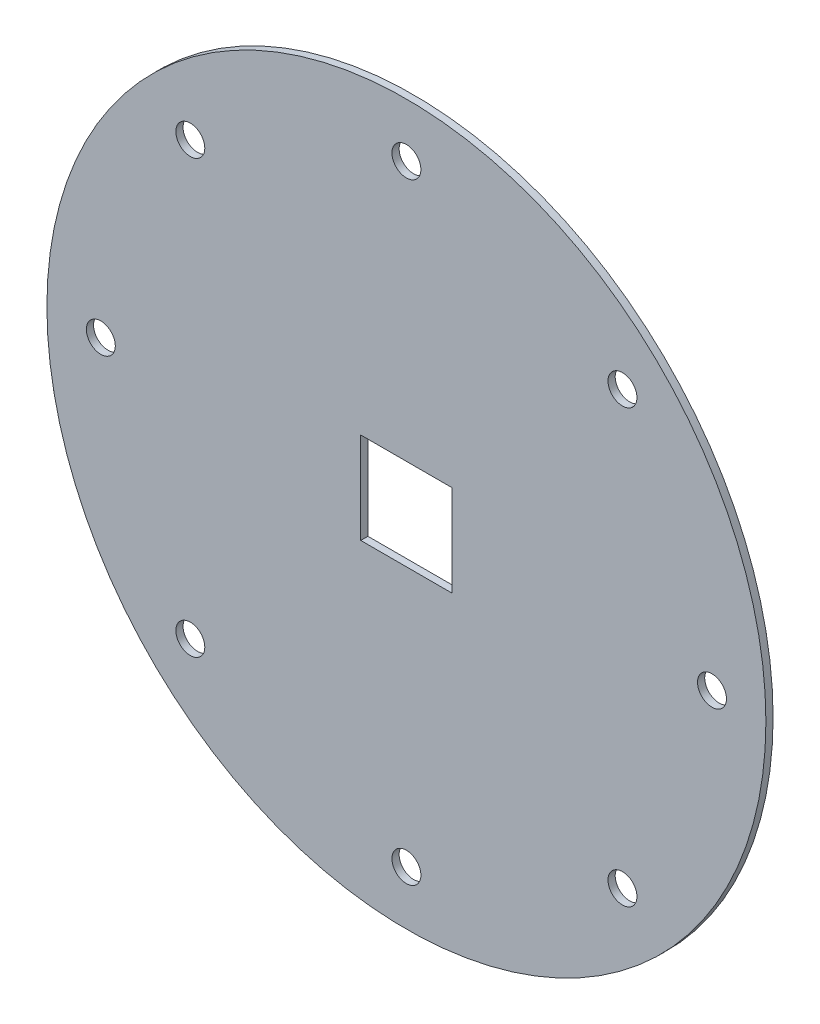
from build123d import *

# Parameters (mm, degrees)
CROQUIS1_R              = 100
CROQUIS1_R_2            = 4.025
CROQUIS1_W              = 25.4
CROQUIS1_H              = 25.4
SALIENTE_EXTRUIR1_DEPTH = 2


with BuildPart() as part:
    # Croquis1 → Saliente-Extruir1 (new body)
    with BuildSketch(Plane.XY):
        Circle(CROQUIS1_R)
        with Locations((0, 85)):
            Circle(CROQUIS1_R_2, mode=Mode.SUBTRACT)
        with Locations((60.104076401, 60.104076401)):
            Circle(CROQUIS1_R_2, mode=Mode.SUBTRACT)
        with Locations((85, 0)):
            Circle(CROQUIS1_R_2, mode=Mode.SUBTRACT)
        with Locations((60.104076401, -60.104076401)):
            Circle(CROQUIS1_R_2, mode=Mode.SUBTRACT)
        with Locations((0, -85)):
            Circle(CROQUIS1_R_2, mode=Mode.SUBTRACT)
        with Locations((-60.104076401, -60.104076401)):
            Circle(CROQUIS1_R_2, mode=Mode.SUBTRACT)
        with Locations((-85, 0)):
            Circle(CROQUIS1_R_2, mode=Mode.SUBTRACT)
        with Locations((-60.104076401, 60.104076401)):
            Circle(CROQUIS1_R_2, mode=Mode.SUBTRACT)
        Rectangle(CROQUIS1_W, CROQUIS1_H, mode=Mode.SUBTRACT)
    extrude(amount=SALIENTE_EXTRUIR1_DEPTH)


solid = part.part
